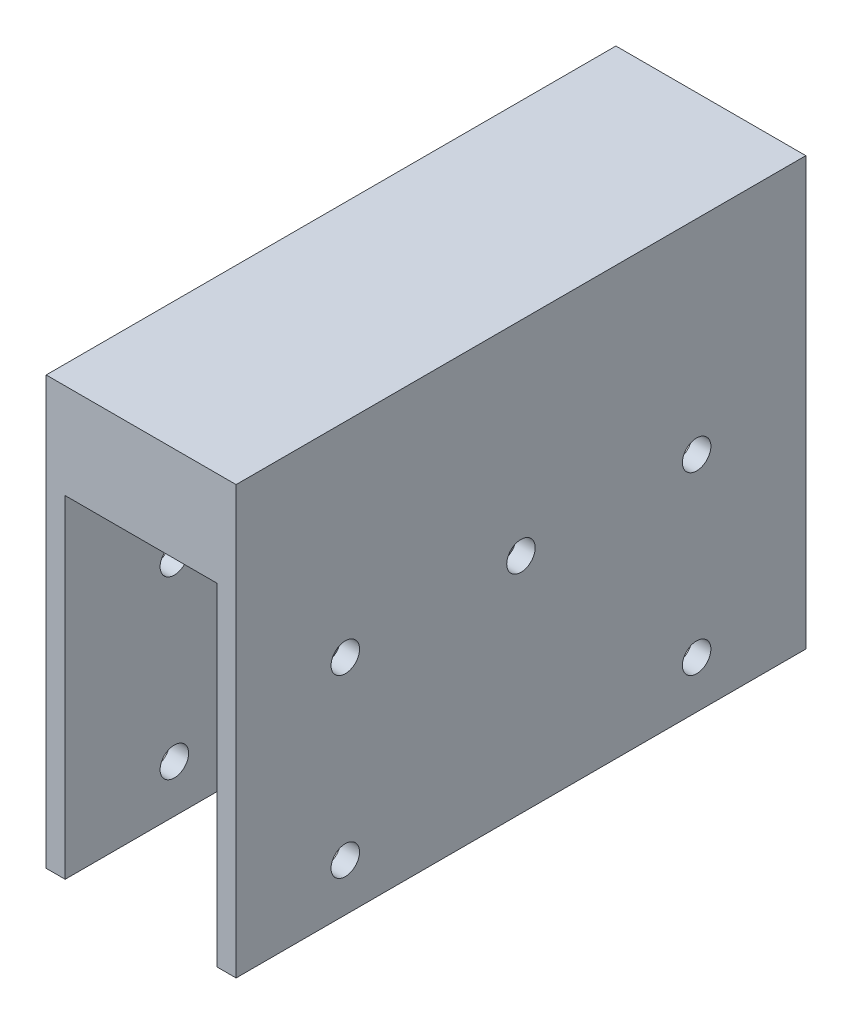
from build123d import *

# Parameters (mm, degrees)
SKETCH1_W           = 10
SKETCH1_H           = 22.5
BOSS_EXTRUDE1_DEPTH = 30
CUT_EXTRUDE1_REACH  = 34.428
SKETCH2_W           = 4
SKETCH2_H           = 17.5
SKETCH3_R           = 0.75
CUT_EXTRUDE2_DEPTH  = 34.564303955
SKETCH4_R           = 0.75
CUT_EXTRUDE3_DEPTH  = 34.564303955


with BuildPart() as part:
    # Sketch1 → Boss-Extrude1 (new body)
    with BuildSketch(Plane.XY):
        Rectangle(SKETCH1_W, SKETCH1_H)
    extrude(amount=BOSS_EXTRUDE1_DEPTH)

    # Sketch2 → Cut-Extrude1 (cut, up to next)
    with BuildSketch(Plane.XY.offset(30), mode=Mode.PRIVATE) as cut_extrude1_sk1:
        with Locations((-2, -2.5)):
            Rectangle(SKETCH2_W, SKETCH2_H)
    cut_extrude1_tool1 = extrude(cut_extrude1_sk1.sketch, amount=-CUT_EXTRUDE1_REACH, mode=Mode.PRIVATE) & part.part
    cut_extrude1 = cut_extrude1_tool1.solids().sort_by_distance((-2, -2.5, 30))[0]
    add(cut_extrude1, mode=Mode.SUBTRACT)

    # Mirror1: Cut-Extrude1 across plane
    add(cut_extrude1.mirror(Plane(origin=(0, 0, 0), x_dir=(0, 0, 1), z_dir=(1, 0, 0))), mode=Mode.SUBTRACT)

    # Sketch3 → Cut-Extrude2 (cut, through all)
    with BuildSketch(Plane(origin=(5, 0, 0), x_dir=(0, 0, -1), z_dir=(1, 0, 0))):
        with Locations((-5.75, -8.75)):
            Circle(SKETCH3_R)
        with Locations((-5.75, 0.5)):
            Circle(SKETCH3_R)
    cut_extrude2 = extrude(amount=-CUT_EXTRUDE2_DEPTH, mode=Mode.SUBTRACT)

    # Mirror2: Cut-Extrude2 across plane
    add(cut_extrude2.mirror(Plane.XY.offset(15)), mode=Mode.SUBTRACT)

    # Sketch4 → Cut-Extrude3 (cut, through all)
    with BuildSketch(Plane.ZY.offset(5)):
        with Locations((15, 0.5)):
            Circle(SKETCH4_R)
    extrude(amount=-CUT_EXTRUDE3_DEPTH, mode=Mode.SUBTRACT)


solid = part.part
